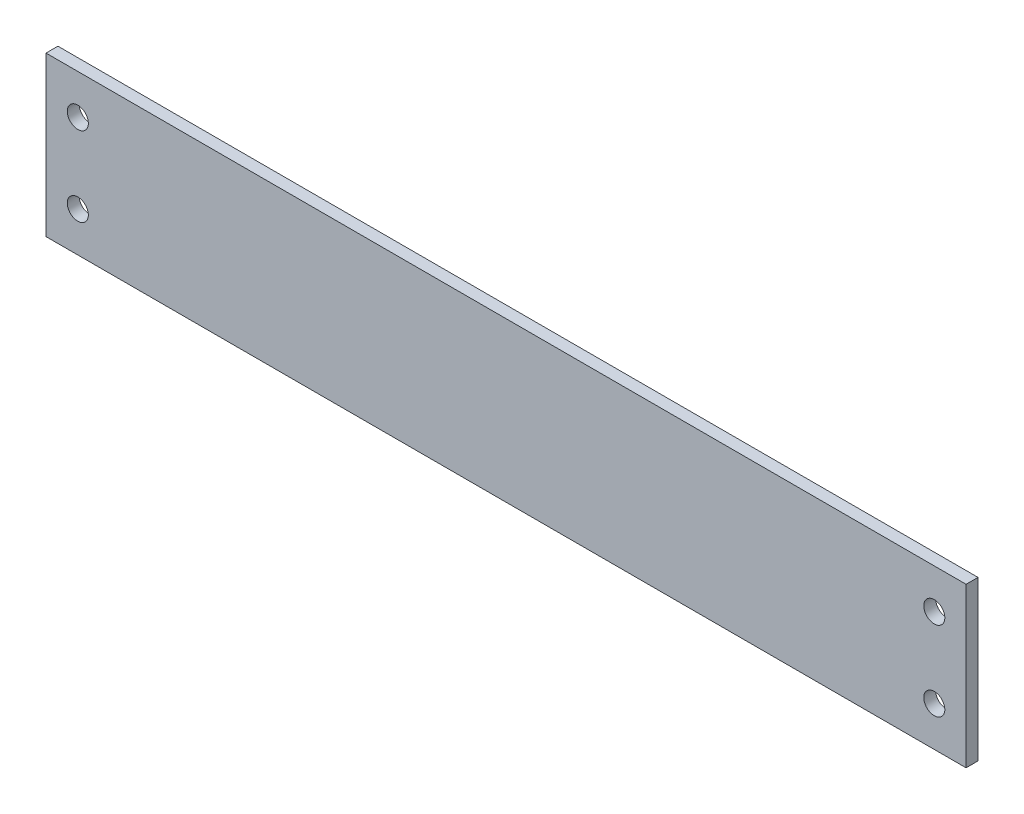
from build123d import *

# Parameters (mm, degrees)
EXTRUSION_BASE_SKETCH_W      = 231.5
EXTRUSION_BASE_SKETCH_H      = 40
EXTRUSION_BASE_SKETCH_R      = 2.65
EXTRUSION_BASE_EXTRUDE_DEPTH = 3


with BuildPart() as part:
    # Extrusion Base Sketch → Extrusion Base Extrude (new body)
    with BuildSketch(Plane.XY):
        with Locations((93.75, 16.75)):
            Rectangle(EXTRUSION_BASE_SKETCH_W, EXTRUSION_BASE_SKETCH_H)
        with Locations((-14, 26.75)):
            Circle(EXTRUSION_BASE_SKETCH_R, mode=Mode.SUBTRACT)
        with Locations((-14, 6.75)):
            Circle(EXTRUSION_BASE_SKETCH_R, mode=Mode.SUBTRACT)
        with Locations((201.5, 26.75)):
            Circle(EXTRUSION_BASE_SKETCH_R, mode=Mode.SUBTRACT)
        with Locations((201.5, 6.75)):
            Circle(EXTRUSION_BASE_SKETCH_R, mode=Mode.SUBTRACT)
    extrude(amount=-EXTRUSION_BASE_EXTRUDE_DEPTH)


solid = part.part
